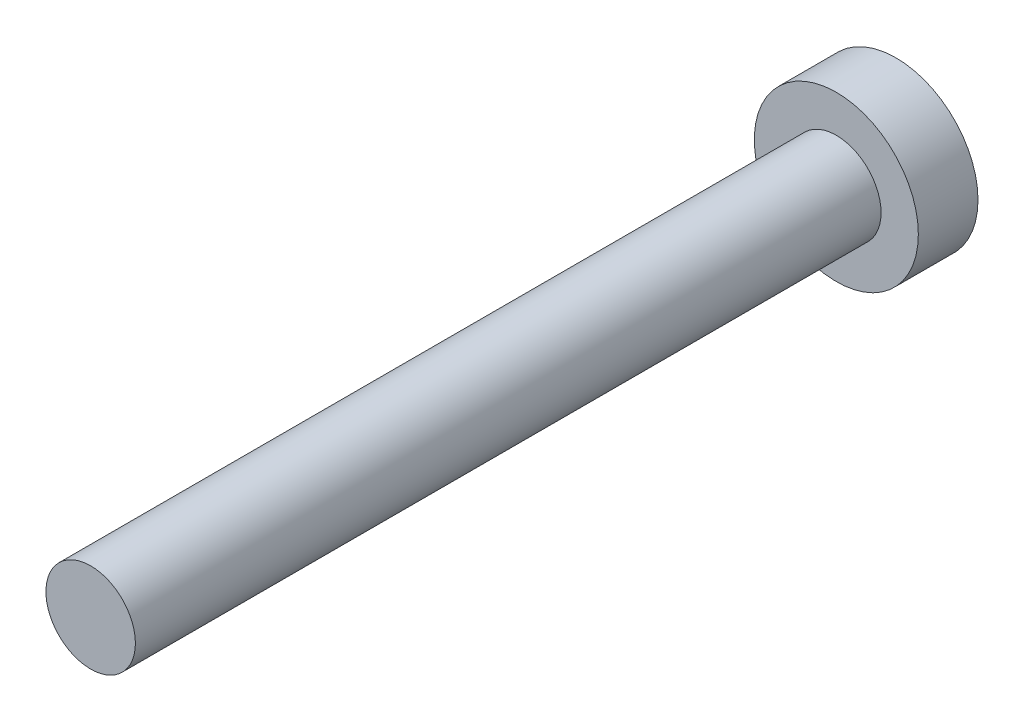
from build123d import *

# Parameters (mm, degrees)
ESQUISSE1_R        = 2.75
BOSS_EXTRU_1_DEPTH = 2
ESQUISSE2_R        = 1.5
BOSS_EXTRU_2_DEPTH = 25


with BuildPart() as part:
    # Esquisse1 → Boss.-Extru.1 (new body)
    with BuildSketch(Plane.XY):
        Circle(ESQUISSE1_R)
    extrude(amount=BOSS_EXTRU_1_DEPTH)

    # Esquisse2 → Boss.-Extru.2 (add)
    with BuildSketch(Plane.XY.offset(2)):
        Circle(ESQUISSE2_R)
    extrude(amount=BOSS_EXTRU_2_DEPTH)


solid = part.part
